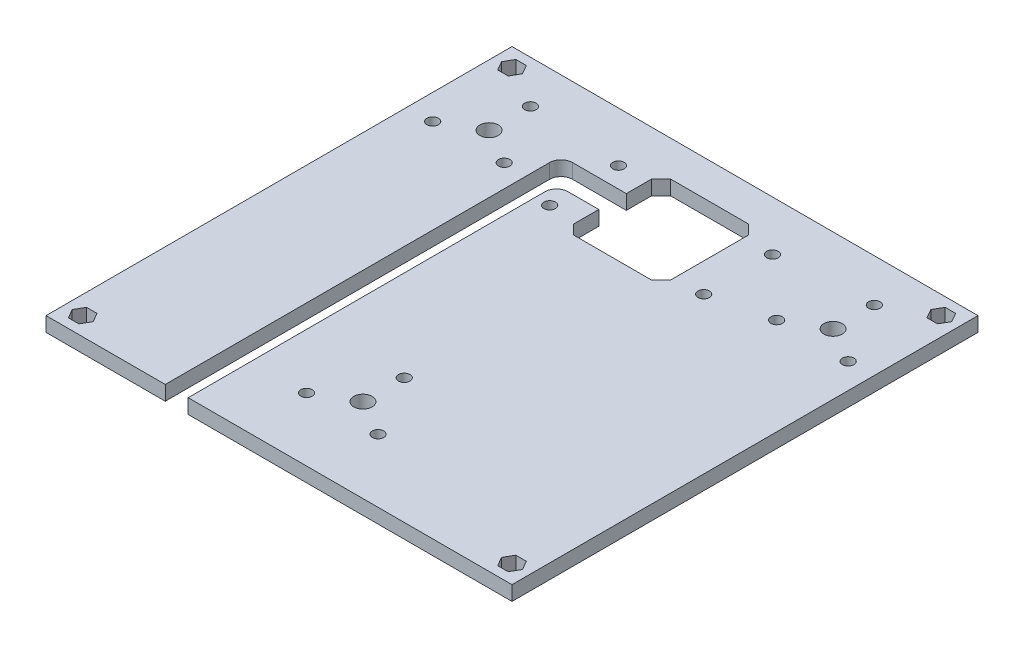
from build123d import *

# Parameters (mm, degrees)
ESQUISSE1_W                  = 203.2
ESQUISSE1_H                  = 203.2
BOSS_EXTRU_1_DEPTH           = 6.35
ESQUISSE2_R                  = 4
ENL_V_MAT_EXTRU_1_DEPTH      = 144.824345992
ENL_V_MAT_EXTRU_2_DEPTH      = 144.824345992
ENL_V_MAT_EXTRU_3_DEPTH      = 144.824345992
CONG_1_R                     = 5
ESQUISSE5_R                  = 2.5
ENL_V_MAT_EXTRU_4_DEPTH      = 144.824345992
ESQUISSE6_R                  = 2.5
ENL_V_MAT_EXTRU_5_DEPTH      = 144.824345992
ENL_V_MAT_EXTRU_6_DEPTH      = 144.824345992
ENL_V_MAT_EXTRU_6_DEPTH_BACK = 144.824345992
ESQUISSE8_R                  = 2.5
ENL_V_MAT_EXTRU_7_DEPTH      = 144.824345992


with BuildPart() as part:
    # Esquisse1 → Boss.-Extru.1 (new body)
    with BuildSketch(Plane(origin=(0, 0, 0), x_dir=(1, 0, 0), z_dir=(0, 1, 0))):
        Rectangle(ESQUISSE1_W, ESQUISSE1_H)
    extrude(amount=BOSS_EXTRU_1_DEPTH)

    # Esquisse2 → Enlèv. mat.-Extru.1 (cut, through all)
    with BuildSketch(Plane(origin=(0, 6.35, 0), x_dir=(1, 0, 0), z_dir=(0, 1, 0))):
        with Locations((-75, 65)):
            Circle(ESQUISSE2_R)
        with Locations((75, 65)):
            Circle(ESQUISSE2_R)
        with Locations((0, -65)):
            Circle(ESQUISSE2_R)
    extrude(amount=-ENL_V_MAT_EXTRU_1_DEPTH, mode=Mode.SUBTRACT)

    # Esquisse3 → Enlèv. mat.-Extru.2 (cut, through all)
    with BuildSketch(Plane(origin=(0, 6.35, 0), x_dir=(1, 0, 0), z_dir=(0, 1, 0))):
        Polygon((-17.05, 86.15), (-21.15, 82.05), (-21.15, 47.95), (-17.05, 43.85), (17.05, 43.85), (21.15, 47.95), (21.15, 82.05), (17.05, 86.15), align=None)
    extrude(amount=-ENL_V_MAT_EXTRU_2_DEPTH, mode=Mode.SUBTRACT)

    # Esquisse4 → Enlèv. mat.-Extru.3 (cut, through all)
    with BuildSketch(Plane(origin=(0, 6.35, 0), x_dir=(1, 0, 0), z_dir=(0, 1, 0))):
        Polygon((-49.6, -101.6), (-39.6, -101.6), (-39.6, 59), (-21.15, 59), (-21.15, 71), (-49.6, 71), align=None)
    extrude(amount=-ENL_V_MAT_EXTRU_3_DEPTH, mode=Mode.SUBTRACT)

    # Congé1
    cong_1_edges = [part.edges().sort_by_distance(p)[0] for p in [
        (-49.6, 3.175, -71),
        (-39.6, 3.175, -59),
    ]]
    fillet(cong_1_edges, radius=CONG_1_R)

    # Esquisse5 → Enlèv. mat.-Extru.4 (cut, through all)
    with BuildSketch(Plane(origin=(0, 6.35, 0), x_dir=(1, 0, 0), z_dir=(0, 1, 0))):
        with Locations((-33.425, 49.85)):
            Circle(ESQUISSE5_R)
        with Locations((-33.425, 79.85)):
            Circle(ESQUISSE5_R)
        with Locations((33.725, 79.85)):
            Circle(ESQUISSE5_R)
        with Locations((33.725, 49.85)):
            Circle(ESQUISSE5_R)
    extrude(amount=-ENL_V_MAT_EXTRU_4_DEPTH, mode=Mode.SUBTRACT)

    # Esquisse6 → Enlèv. mat.-Extru.5 (cut, through all)
    with BuildSketch(Plane(origin=(0, 6.35, 0), x_dir=(1, 0, 0), z_dir=(0, 1, 0))):
        with Locations((93.6, -93.6)):
            Circle(ESQUISSE6_R)
        with Locations((-93.6, -93.6)):
            Circle(ESQUISSE6_R)
        with Locations((-93.6, 93.6)):
            Circle(ESQUISSE6_R)
        with Locations((93.6, 93.6)):
            Circle(ESQUISSE6_R)
    extrude(amount=-ENL_V_MAT_EXTRU_5_DEPTH, mode=Mode.SUBTRACT)

    # Esquisse7 → Enlèv. mat.-Extru.6 (cut, two sides: drawn at the far end of the back side and taken through both)
    with BuildSketch(Plane(origin=(0, 6.35, 0), x_dir=(1, 0, 0), z_dir=(0, 1, 0)).offset(-ENL_V_MAT_EXTRU_6_DEPTH_BACK)):
        Polygon((-98.172614132, -93.6), (-95.886307066, -97.56), (-91.313692934, -97.56), (-89.027385868, -93.6), (-91.313692934, -89.64), (-95.886307066, -89.64), align=None)
        Polygon((89.027385868, -93.6), (91.313692934, -97.56), (95.886307066, -97.56), (98.172614132, -93.6), (95.886307066, -89.64), (91.313692934, -89.64), align=None)
        Polygon((89.027385868, 93.6), (91.313692934, 89.64), (95.886307066, 89.64), (98.172614132, 93.6), (95.886307066, 97.56), (91.313692934, 97.56), align=None)
        Polygon((-98.172614132, 93.6), (-95.886307066, 89.64), (-91.313692934, 89.64), (-89.027385868, 93.6), (-91.313692934, 97.56), (-95.886307066, 97.56), align=None)
    extrude(amount=ENL_V_MAT_EXTRU_6_DEPTH + ENL_V_MAT_EXTRU_6_DEPTH_BACK, mode=Mode.SUBTRACT)

    # Esquisse8 → Enlèv. mat.-Extru.7 (cut, through all)
    with BuildSketch(Plane(origin=(0, 6.35, 0), x_dir=(1, 0, 0), z_dir=(0, 1, 0))):
        with Locations((90.588457268, 56)):
            Circle(ESQUISSE8_R)
        with Locations((59.411542732, 56)):
            Circle(ESQUISSE8_R)
        with Locations((75, 83)):
            Circle(ESQUISSE8_R)
        with Locations((-90.588457268, 56)):
            Circle(ESQUISSE8_R)
        with Locations((-75, 83)):
            Circle(ESQUISSE8_R)
        with Locations((-59.411542732, 56)):
            Circle(ESQUISSE8_R)
        with Locations((15.588457268, -74)):
            Circle(ESQUISSE8_R)
        with Locations((-15.588457268, -74)):
            Circle(ESQUISSE8_R)
        with Locations((0, -47)):
            Circle(ESQUISSE8_R)
    extrude(amount=-ENL_V_MAT_EXTRU_7_DEPTH, mode=Mode.SUBTRACT)


solid = part.part
